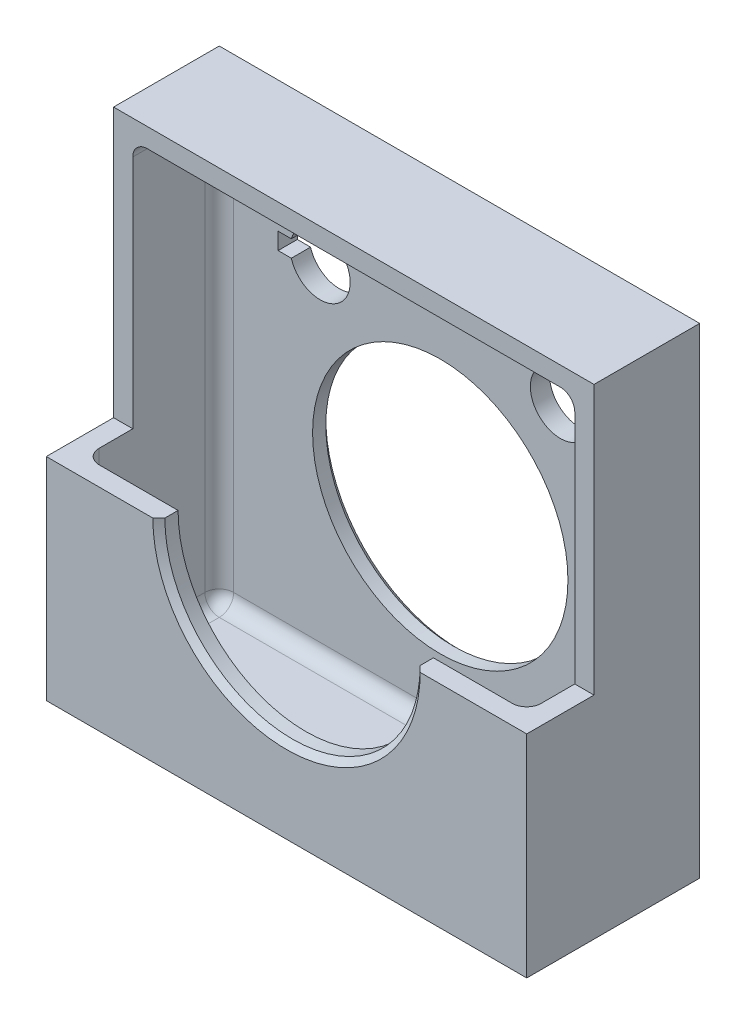
from build123d import *

# Parameters (mm, degrees)
SKETCH1_W          = 50.8
SKETCH1_H          = 50.8
MAIN_BODY_DEPTH    = 18.288
SKETCH2_W          = 7.112
SKETCH2_H          = 28.448
FRONT_CUT_DEPTH    = 75.133197314
SHELL1_T           = -2.032
SKETCH3_R          = 13.5001
CENTER_HOLE_DEPTH  = 75.133197314
FILL060_VERT_R     = 1.524
FILL060_TB_R       = 1.524
CHAM025_SIZE       = 0.635
KEYED_HOLE_1_DEPTH = 60.460200948


with BuildPart() as part:
    # Sketch1 → main body (new body)
    with BuildSketch(Plane.XY):
        with Locations((25.4, 25.4)):
            Rectangle(SKETCH1_W, SKETCH1_H)
    extrude(amount=MAIN_BODY_DEPTH)

    # Sketch2 → front cut (cut, through all)
    with BuildSketch(Plane(origin=(50.8, 0, 0), x_dir=(0, 0, -1), z_dir=(1, 0, 0))):
        with Locations((-14.732, 36.576)):
            Rectangle(SKETCH2_W, SKETCH2_H)
    extrude(amount=-FRONT_CUT_DEPTH, mode=Mode.SUBTRACT)

    # Shell1
    shell1_openings = [part.faces().sort_by_distance(p)[0] for p in [
        (25.4, 22.352, 14.732),
        (25.4, 36.576, 11.176),
    ]]
    offset(amount=SHELL1_T, openings=shell1_openings, kind=Kind.INTERSECTION)

    # Sketch3 → center hole (cut, through all)
    with BuildSketch(Plane.XY):
        with Locations((25.4, 22.352)):
            Circle(SKETCH3_R)
    extrude(amount=CENTER_HOLE_DEPTH, mode=Mode.SUBTRACT)

    # fill060.vert
    fill060_vert_edges = [part.edges().sort_by_distance(p)[0] for p in [
        (2.032, 12.192, 16.256),
        (48.768, 12.192, 16.256),
        (2.032, 25.4, 2.032),
        (48.768, 25.4, 2.032),
    ]]
    fillet(fill060_vert_edges, radius=FILL060_VERT_R)

    # fill060.tb
    fill060_tb_edges = [part.edges().sort_by_distance(p)[0] for p in [
        (48.768, 48.768, 7.366),
        (2.032, 48.768, 7.366),
        (48.321630735, 48.768, 2.478369265),
        (2.478369265, 48.768, 2.478369265),
        (25.4, 48.768, 2.032),
        (25.4, 2.032, 2.032),
        (2.478369265, 2.032, 2.478369265),
        (48.321630735, 2.032, 2.478369265),
        (2.032, 2.032, 9.144),
        (48.768, 2.032, 9.144),
        (2.478369265, 2.032, 15.809630735),
        (48.321630735, 2.032, 15.809630735),
        (25.4, 2.032, 16.256),
    ]]
    fillet(fill060_tb_edges, radius=FILL060_TB_R)

    # cham025
    cham025_edges = [part.edges().sort_by_distance(p)[0] for p in [
        (25.4, 8.8519, 18.288),
        (11.8999, 22.352, 0),
    ]]
    chamfer(cham025_edges, length=CHAM025_SIZE)

    # Sketch6 → Keyed Hole 1 (cut, through all)
    with BuildSketch(Plane(origin=(10.255789697, 39.461773448, 0), x_dir=(-1, 0, 0), z_dir=(0, 0, -1))):
        with BuildLine():
            Line((0.603789697, -0.472773448), (2.000789697, -0.472773448))
            Line((2.000789697, -0.472773448), (2.000789697, -2.250773448))
            Line((2.000789697, -2.250773448), (0.603789697, -2.250773448))
            ThreePointArc((0.603789697, -2.250773448), (-5.619210303, -1.361773448), (0.603789697, -0.472773448))
        make_face()
    keyed_hole_1 = extrude(amount=-KEYED_HOLE_1_DEPTH, mode=Mode.SUBTRACT)

    # 鏡射1: Keyed Hole 1 across plane
    add(keyed_hole_1.mirror(Plane(origin=(25.4, 0, 0), x_dir=(0, 0, 1), z_dir=(1, 0, 0))), mode=Mode.SUBTRACT)


solid = part.part
